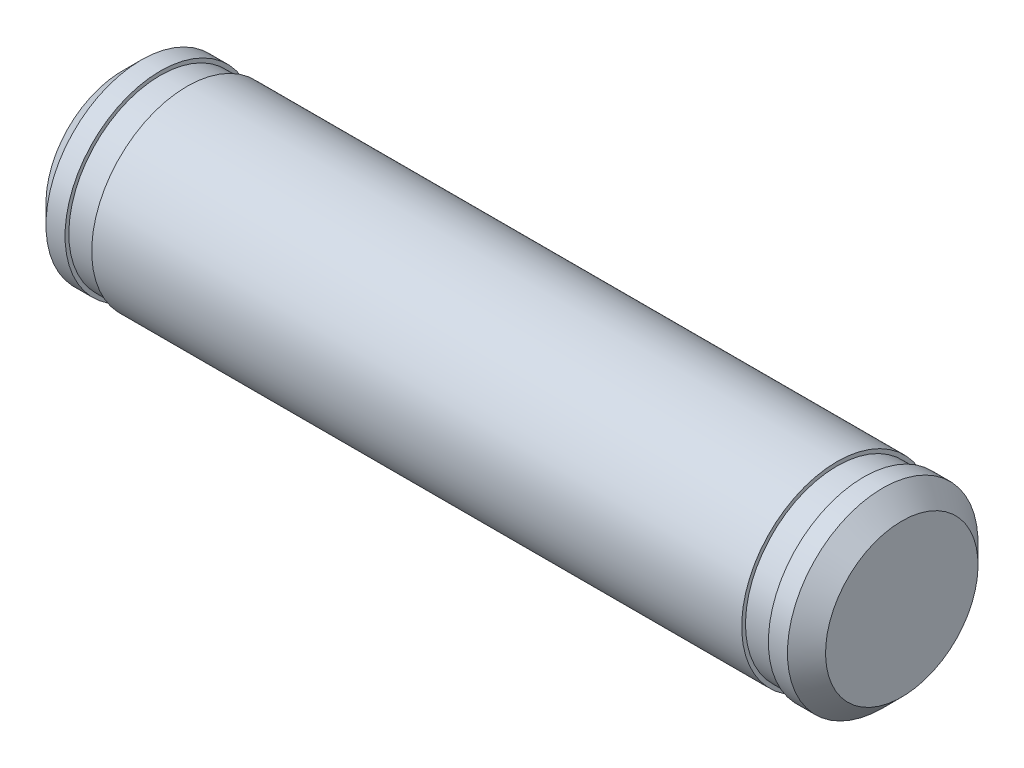
from build123d import *

# Parameters (mm, degrees)
CHAMFER_1_SIZE = 0.5


with BuildPart() as part:
    # 草图1 → 旋转1 (revolve)
    with BuildSketch(Plane.XY):
        Polygon((10.225, 0), (10.225, 2.5), (9.225, 2.5), (9.225, 2.4), (8.525, 2.4), (8.525, 2.5), (-8.525, 2.5), (-8.525, 2.4), (-9.225, 2.4), (-9.225, 2.5), (-10.225, 2.5), (-10.225, 0), align=None)
    revolve(axis=Axis((10.225, 0, 0), (-1, 0, 0)))

    # 倒角1
    chamfer_1_edges = [part.edges().sort_by_distance(p)[0] for p in [
        (-10.225, -2.5, 0),
        (10.225, -2.5, 0),
    ]]
    chamfer(chamfer_1_edges, length=CHAMFER_1_SIZE)


solid = part.part
